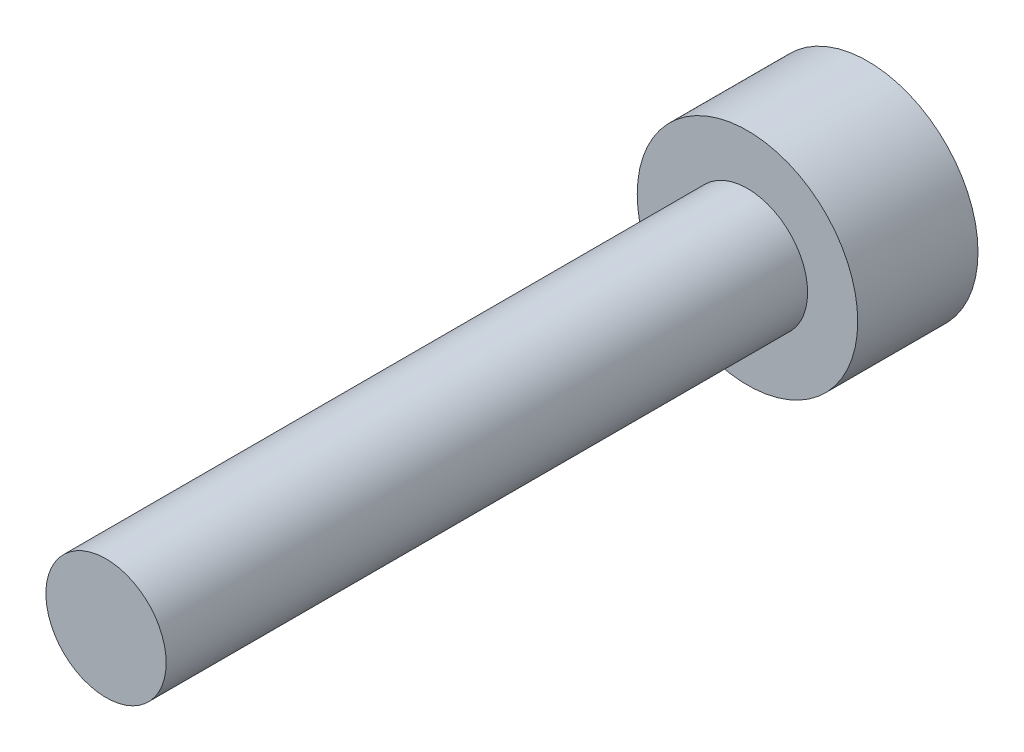
from build123d import *

# Parameters (mm, degrees)
CORTE_EXTRUS_O1_DEPTH = 1.5


with BuildPart() as part:
    # Esboço1 → Revolução1 (revolve)
    with BuildSketch(Plane(origin=(0, 0, 0), x_dir=(1, 0, 0), z_dir=(0, 1, 0))):
        Polygon((0, 0), (2.75, 0), (2.75, -3), (1.5, -3), (1.5, -19), (0, -19), (0, -3), align=None)
    revolve(axis=Axis((0, 0, 3), (0, 0, -1)))

    # Esboço2 → Corte-extrusão1 (cut)
    with BuildSketch(Plane(origin=(0, 0, 0), x_dir=(-1, 0, 0), z_dir=(0, 0, -1))):
        Polygon((1.732050808, 0), (0.866025404, 1.5), (-0.866025404, 1.5), (-1.732050808, 0), (-0.866025404, -1.5), (0.866025404, -1.5), align=None)
    extrude(amount=-CORTE_EXTRUS_O1_DEPTH, mode=Mode.SUBTRACT)


solid = part.part
